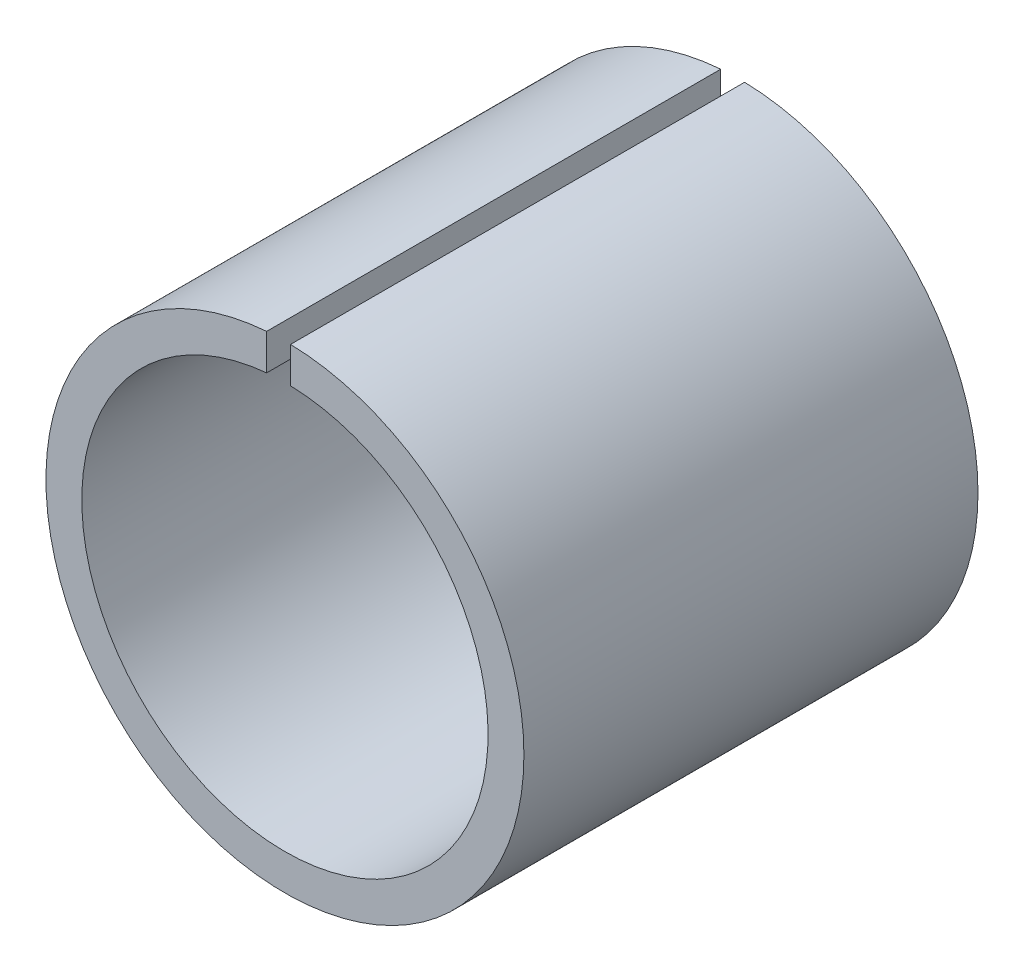
from build123d import *

# Parameters (mm, degrees)
SKETCH1_R           = 10
BOSS_EXTRUDE1_DEPTH = 19
SKETCH3_R           = 8.5
CUT_EXTRUDE1_DEPTH  = 19
SKETCH4_W           = 1
SKETCH4_H           = 19
CUT_EXTRUDE3_DEPTH  = 3


with BuildPart() as part:
    # Sketch1 → Boss-Extrude1 (new body)
    with BuildSketch(Plane.XY):
        Circle(SKETCH1_R)
    extrude(amount=BOSS_EXTRUDE1_DEPTH)

    # Sketch3 → Cut-Extrude1 (cut)
    with BuildSketch(Plane.XY.offset(19)):
        Circle(SKETCH3_R)
    extrude(amount=-CUT_EXTRUDE1_DEPTH, mode=Mode.SUBTRACT)

    # Sketch4 → Cut-Extrude3 (cut)
    with BuildSketch(Plane(origin=(0, 8, 0), x_dir=(1, 0, 0), z_dir=(0, 1, 0))):
        with Locations((-0.265251336, -9.5)):
            Rectangle(SKETCH4_W, SKETCH4_H)
    extrude(amount=CUT_EXTRUDE3_DEPTH, mode=Mode.SUBTRACT)


solid = part.part
